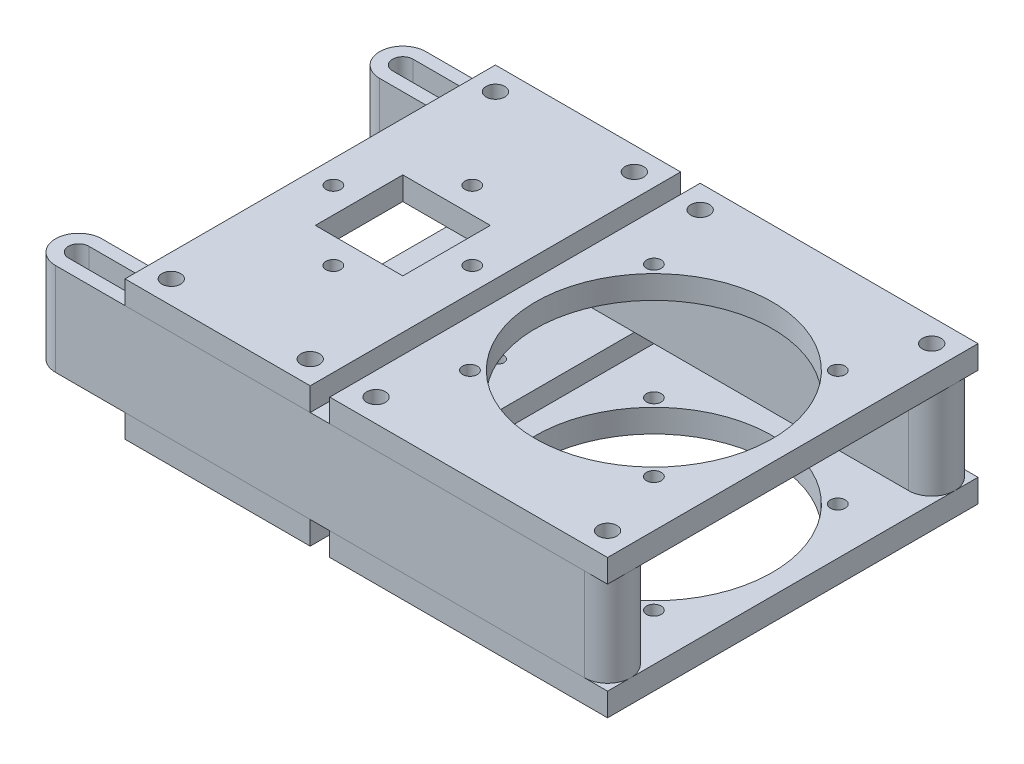
from build123d import *

# Parameters (mm, degrees)
BOSS_EXTRUDE1_START   = 19.05
SKETCH2_W             = 76.2
SKETCH2_H             = 101.6
SKETCH2_R             = 32.5
BOSS_EXTRUDE1_DEPTH   = 6.35
SKETCH2_W_2           = 50.8
BOSS_EXTRUDE1_2_DEPTH = 6.35
SKETCH3_W             = 24
SKETCH3_H             = 24
CUT_EXTRUDE1_DEPTH    = 6.35
SKETCH4_R             = 11.176
CUT_EXTRUDE2_DEPTH    = 6.35
SKETCH5_R             = 1.7272
CUT_EXTRUDE3_DEPTH    = 6.35
SKETCH6_R             = 2.5527
SKETCH6_R_2           = 2.0193
CUT_EXTRUDE4_DEPTH    = 114.655458877
SKETCH7_R             = 2.0193
CUT_EXTRUDE5_DEPTH    = 6.35
BOSS_EXTRUDE2_DEPTH   = 25.4
BOSS_EXTRUDE2_2_DEPTH = 25.4


with BuildPart() as part:
    # Sketch2 → Boss-Extrude1 (new body)
    with BuildSketch(Plane(origin=(0, 0, 0), x_dir=(1, 0, 0), z_dir=(0, 1, 0)).offset(BOSS_EXTRUDE1_START)):
        Rectangle(SKETCH2_W, SKETCH2_H)
        with Locations(Location((0, 0, 0), (0, 0, 270))):
            Circle(SKETCH2_R, mode=Mode.SUBTRACT)
    extrude(amount=-BOSS_EXTRUDE1_DEPTH)


with BuildPart() as body_2:
    # Sketch2 → Boss-Extrude1 2 (new body)
    with BuildSketch(Plane(origin=(0, 0, 0), x_dir=(1, 0, 0), z_dir=(0, 1, 0)).offset(BOSS_EXTRUDE1_START)):
        with Locations((-68.86194, 0)):
            Rectangle(SKETCH2_W_2, SKETCH2_H)
    extrude(amount=-BOSS_EXTRUDE1_2_DEPTH)


with BuildPart() as body_3:
    # Mirror1: mirrored copy
    add(part.part.mirror(Plane.ZX))


with BuildPart() as body_4:
    # Mirror1 2: mirrored copy
    add(body_2.part.mirror(Plane.ZX))

    # Sketch4 → Cut-Extrude2 (cut)
    with BuildSketch(Plane.XZ.offset(19.05)):
        with Locations(Location((-68.86194, 0, 0), (0, 0, 270))):
            Circle(SKETCH4_R)
    extrude(amount=-CUT_EXTRUDE2_DEPTH, mode=Mode.SUBTRACT)

    # Sketch5 → Cut-Extrude3 (cut)
    with BuildSketch(Plane.XZ.offset(19.05)):
        with Locations(Location((-81.86674, 13.0048, 0), (0, 0, 270))):
            Circle(SKETCH5_R)
        with Locations(Location((-55.85714, 13.0048, 0), (0, 0, 270))):
            Circle(SKETCH5_R)
        with Locations(Location((-55.85714, -13.0048, 0), (0, 0, 270))):
            Circle(SKETCH5_R)
        with Locations(Location((-81.86674, -13.0048, 0), (0, 0, 270))):
            Circle(SKETCH5_R)
    extrude(amount=-CUT_EXTRUDE3_DEPTH, mode=Mode.SUBTRACT)


with BuildPart() as body_2_1:
    add(body_2.part)

    # Sketch3 → Cut-Extrude1 (cut)
    with BuildSketch(Plane(origin=(0, 19.05, 0), x_dir=(1, 0, 0), z_dir=(0, 1, 0))):
        with Locations((-68.86194, 0)):
            Rectangle(SKETCH3_W, SKETCH3_H)
    extrude(amount=-CUT_EXTRUDE1_DEPTH, mode=Mode.SUBTRACT)


with BuildPart() as cut_extrude4_tool:
    # Sketch6 → Cut-Extrude4 (new, through all)
    with BuildSketch(Plane(origin=(0, 19.05, 0), x_dir=(1, 0, 0), z_dir=(0, 1, 0))):
        with Locations(Location((-31.75, 44.45, 0), (0, 0, 270))):
            Circle(SKETCH6_R)
        with Locations(Location((31.75, 44.45, 0), (0, 0, 270))):
            Circle(SKETCH6_R)
        with Locations(Location((31.75, -44.45, 0), (0, 0, 270))):
            Circle(SKETCH6_R)
        with Locations(Location((-31.75, -44.45, 0), (0, 0, 270))):
            Circle(SKETCH6_R)
        with Locations(Location((-25.226034419, 25.226034419, 0), (0, 0, 270))):
            Circle(SKETCH6_R_2)
        with Locations(Location((25.226034419, 25.226034419, 0), (0, 0, 270))):
            Circle(SKETCH6_R_2)
        with Locations(Location((25.226034419, -25.226034419, 0), (0, 0, 270))):
            Circle(SKETCH6_R_2)
        with Locations(Location((-25.226034419, -25.226034419, 0), (0, 0, 270))):
            Circle(SKETCH6_R_2)
        with Locations(Location((-49.81194, -44.45, 0), (0, 0, 270))):
            Circle(SKETCH6_R)
        with Locations(Location((-49.81194, 44.45, 0), (0, 0, 270))):
            Circle(SKETCH6_R)
        with Locations(Location((-87.91194, -44.45, 0), (0, 0, 270))):
            Circle(SKETCH6_R)
        with Locations(Location((-87.91194, 44.45, 0), (0, 0, 270))):
            Circle(SKETCH6_R)
    extrude(amount=-CUT_EXTRUDE4_DEPTH)


with BuildPart() as part_1:
    add(part.part)

    # Cut-Extrude4: cut by cut_extrude4_tool
    add(cut_extrude4_tool.part, mode=Mode.SUBTRACT)


with BuildPart() as body_2_2:
    add(body_2_1.part)

    # Cut-Extrude4: cut by cut_extrude4_tool
    add(cut_extrude4_tool.part, mode=Mode.SUBTRACT)

    # Sketch7 → Cut-Extrude5 (cut)
    with BuildSketch(Plane(origin=(0, 19.05, 0), x_dir=(1, 0, 0), z_dir=(0, 1, 0))):
        with Locations(Location((-68.86194, 19.05, 0), (0, 0, 270))):
            Circle(SKETCH7_R)
        with Locations(Location((-68.86194, -19.05, 0), (0, 0, 270))):
            Circle(SKETCH7_R)
        with Locations(Location((-87.91194, 0, 0), (0, 0, 270))):
            Circle(SKETCH7_R)
        with Locations(Location((-49.81194, 0, 0), (0, 0, 270))):
            Circle(SKETCH7_R)
    extrude(amount=-CUT_EXTRUDE5_DEPTH, mode=Mode.SUBTRACT)


with BuildPart() as body_3_1:
    add(body_3.part)

    # Cut-Extrude4: cut by cut_extrude4_tool
    add(cut_extrude4_tool.part, mode=Mode.SUBTRACT)


with BuildPart() as body_4_1:
    add(body_4.part)

    # Cut-Extrude4: cut by cut_extrude4_tool
    add(cut_extrude4_tool.part, mode=Mode.SUBTRACT)


with BuildPart() as body_5:
    # Sketch8 → Boss-Extrude2 (new body)
    with BuildSketch(Plane(origin=(0, -12.7, 0), x_dir=(1, 0, 0), z_dir=(0, 1, 0))):
        with BuildLine():
            Line((31.75, -50.8), (-113.31194, -50.8))
            ThreePointArc((-113.31194, -50.8), (-119.66194, -44.45), (-113.31194, -38.1))
            Line((-113.31194, -38.1), (31.75, -38.1))
            ThreePointArc((31.75, -38.1), (38.1, -44.45), (31.75, -50.8))
        make_face()
        with BuildLine():
            Line((-49.81194, -47.244), (-113.31194, -47.244))
            ThreePointArc((-113.31194, -47.244), (-116.10594, -44.45), (-113.31194, -41.656))
            Line((-113.31194, -41.656), (-49.81194, -41.656))
            ThreePointArc((-49.81194, -41.656), (-47.01794, -44.45), (-49.81194, -47.244))
        make_face(mode=Mode.SUBTRACT)
    extrude(amount=BOSS_EXTRUDE2_DEPTH)


with BuildPart() as body_6:
    # Sketch8 → Boss-Extrude2 2 (new body)
    with BuildSketch(Plane(origin=(0, -12.7, 0), x_dir=(1, 0, 0), z_dir=(0, 1, 0))):
        with BuildLine():
            Line((31.75, 38.1), (-113.31194, 38.1))
            ThreePointArc((-113.31194, 38.1), (-119.66194, 44.45), (-113.31194, 50.8))
            Line((-113.31194, 50.8), (31.75, 50.8))
            ThreePointArc((31.75, 50.8), (38.1, 44.45), (31.75, 38.1))
        make_face()
        with BuildLine():
            Line((-49.81194, 41.656), (-113.31194, 41.656))
            ThreePointArc((-113.31194, 41.656), (-116.10594, 44.45), (-113.31194, 47.244))
            Line((-113.31194, 47.244), (-49.81194, 47.244))
            ThreePointArc((-49.81194, 47.244), (-47.01794, 44.45), (-49.81194, 41.656))
        make_face(mode=Mode.SUBTRACT)
    extrude(amount=BOSS_EXTRUDE2_2_DEPTH)


solid = Compound([part_1.part, body_2_2.part, body_3_1.part, body_4_1.part, body_5.part, body_6.part])
